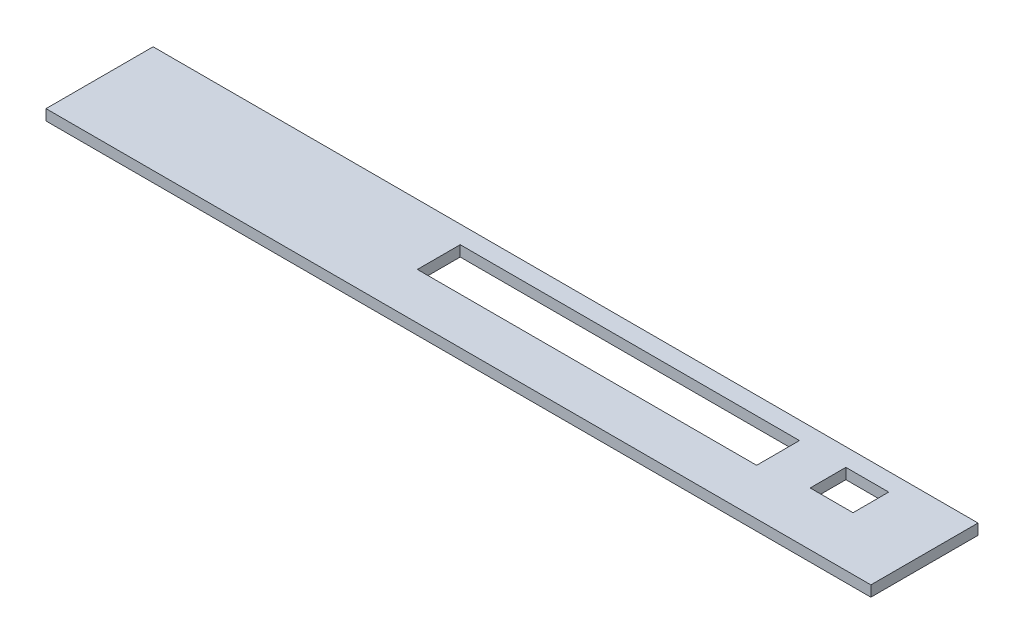
from build123d import *

# Parameters (mm, degrees)
SKETCH_1_W          = 231
SKETCH_1_H          = 30
EXTRUDE_1_DEPTH     = 3
SKETCH_2_W          = 95
SKETCH_2_H          = 12
SKETCH_2_W_2        = 12
SKETCH_2_H_2        = 10
CUT_EXTRUDE_1_DEPTH = 233.9592239


with BuildPart() as part:
    # 草圖1 → 填料-伸長1 (new body)
    with BuildSketch(Plane(origin=(0, 0, 0), x_dir=(1, 0, 0), z_dir=(0, 1, 0))):
        with Locations((115.5, 15)):
            Rectangle(SKETCH_1_W, SKETCH_1_H)
    extrude(amount=EXTRUDE_1_DEPTH)

    # 草圖2 → 除料-伸長1 (cut, through all)
    with BuildSketch(Plane(origin=(0, 3, 0), x_dir=(1, 0, 0), z_dir=(0, 1, 0))):
        with Locations((138.5, 19)):
            Rectangle(SKETCH_2_W, SKETCH_2_H)
        with Locations((205, 20)):
            Rectangle(SKETCH_2_W_2, SKETCH_2_H_2)
    extrude(amount=-CUT_EXTRUDE_1_DEPTH, mode=Mode.SUBTRACT)


solid = part.part
